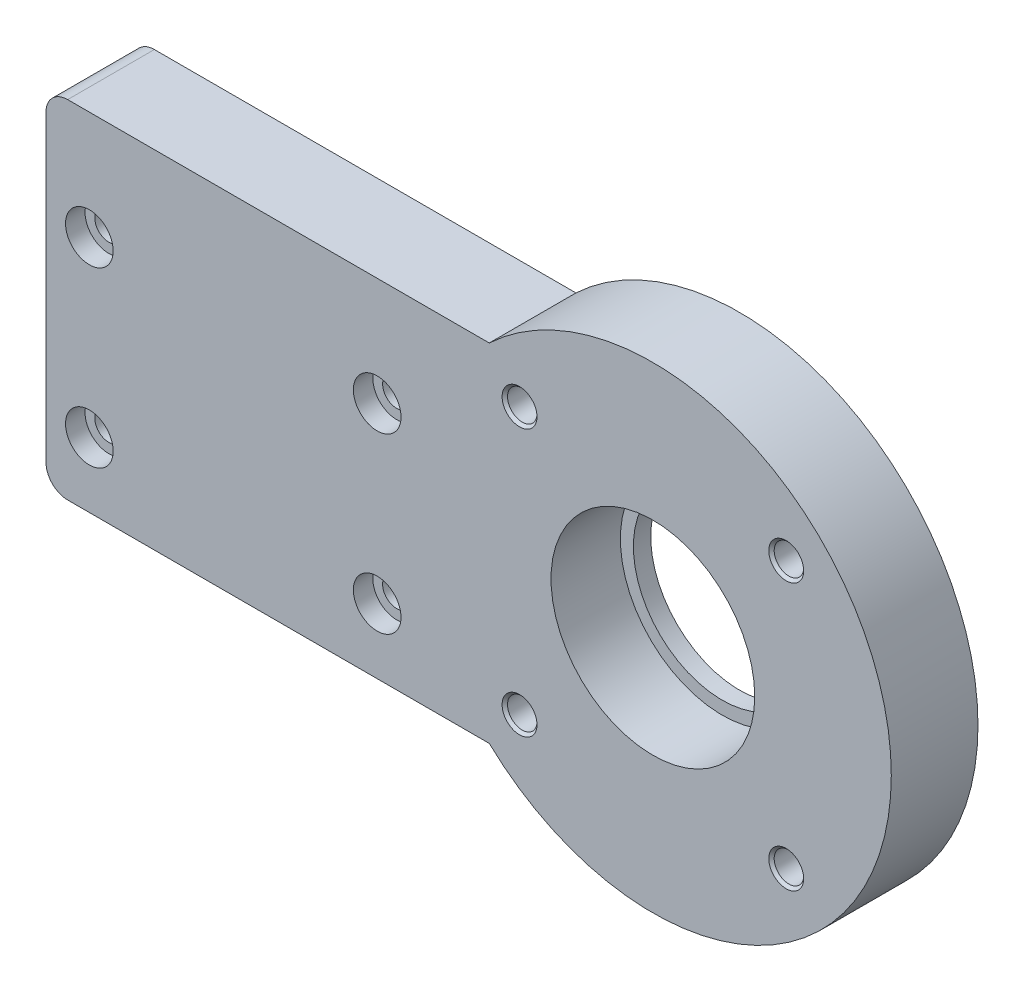
from build123d import *

# Parameters (mm, degrees)
SKETCH1_R                   = 20.5
BOSS_EXTRUDE1_DEPTH         = 20
BOSS_EXTRUDE3_START         = -20
SKETCH6_R                   = 55
SKETCH6_R_2                 = 20.5
BOSS_EXTRUDE3_DEPTH         = 20
SKETCH2_R                   = 23.5
CUT_EXTRUDE1_DEPTH          = 16
SKETCH4_W                   = 85
SKETCH4_H                   = 8
BOSS_EXTRUDE2_DEPTH         = 3
SKETCH3_R                   = 3.25
CUT_EXTRUDE2_DEPTH          = 153.164384795
SKETCH5_R                   = 5.5
CUT_EXTRUDE3_DEPTH          = 4.5
FILLET1_R                   = 5
M8_TAPPED_HOLE1_D           = 6.8
M8_TAPPED_HOLE1_DEPTH       = 16
M8_TAPPED_HOLE1_CSINK_D     = 8.05
M8_TAPPED_HOLE1_CSINK_ANGLE = 90
M8_TAPPED_HOLE1_TIP         = 2.042926105


with BuildPart() as part:
    # Sketch1 → Boss-Extrude1 (new body)
    with BuildSketch(Plane.XY):
        with BuildLine():
            Line((0, 40), (-140, 40))
            Line((-140, 40), (-140, -40))
            Line((-140, -40), (0, -40))
            ThreePointArc((0, -40), (40, 0), (0, 40))
        make_face()
        Circle(SKETCH1_R, mode=Mode.SUBTRACT)
    extrude(amount=BOSS_EXTRUDE1_DEPTH)

    # Sketch6 → Boss-Extrude3 (add)
    with BuildSketch(Plane.XY.offset(20).offset(BOSS_EXTRUDE3_START)):
        Circle(SKETCH6_R)
        Circle(SKETCH6_R_2, mode=Mode.SUBTRACT)
    extrude(amount=BOSS_EXTRUDE3_DEPTH)

    # Sketch2 → Cut-Extrude1 (cut)
    with BuildSketch(Plane.XY.offset(20)):
        Circle(SKETCH2_R)
    extrude(amount=-CUT_EXTRUDE1_DEPTH, mode=Mode.SUBTRACT)

    # Sketch4 → Boss-Extrude2 (add)
    with BuildSketch(Plane(origin=(0, 0, 0), x_dir=(-1, 0, 0), z_dir=(0, 0, -1))):
        with Locations((97.5, -25)):
            Rectangle(SKETCH4_W, SKETCH4_H)
        with Locations((97.5, 15)):
            Rectangle(SKETCH4_W, SKETCH4_H)
    extrude(amount=BOSS_EXTRUDE2_DEPTH)

    # Sketch3 → Cut-Extrude2 (cut, through all)
    with BuildSketch(Plane.XY.offset(20)):
        with Locations((-63.6, 15)):
            Circle(SKETCH3_R)
        with Locations((-130, 15)):
            Circle(SKETCH3_R)
        with Locations((-130, -25)):
            Circle(SKETCH3_R)
        with Locations((-63.6, -25)):
            Circle(SKETCH3_R)
    extrude(amount=-CUT_EXTRUDE2_DEPTH, mode=Mode.SUBTRACT)

    # Sketch5 → Cut-Extrude3 (cut)
    with BuildSketch(Plane.XY.offset(20)):
        with Locations((-130, 15)):
            Circle(SKETCH5_R)
        with Locations((-63.6, 15)):
            Circle(SKETCH5_R)
        with Locations((-63.6, -25)):
            Circle(SKETCH5_R)
        with Locations((-130, -25)):
            Circle(SKETCH5_R)
    extrude(amount=-CUT_EXTRUDE3_DEPTH, mode=Mode.SUBTRACT)

    # Fillet1
    fillet1_edges = [part.edges().sort_by_distance(p)[0] for p in [
        (-140, -40, 10),
        (-140, 40, 10),
    ]]
    fillet(fillet1_edges, radius=FILLET1_R)

    # M8 Tapped Hole1
    with Locations(Plane.XY.offset(20)):
        with Locations((30.759144982, 30.759144982), (-30.759144982, 30.759144982), (-30.759144982, -30.759144982), (30.759144982, -30.759144982)):
            CounterSinkHole(M8_TAPPED_HOLE1_D / 2, M8_TAPPED_HOLE1_CSINK_D / 2, depth=M8_TAPPED_HOLE1_DEPTH, counter_sink_angle=M8_TAPPED_HOLE1_CSINK_ANGLE)
            with Locations((0, 0, -(M8_TAPPED_HOLE1_DEPTH + M8_TAPPED_HOLE1_TIP / 2))):  # 118° drill point
                Cone(0, M8_TAPPED_HOLE1_D / 2, M8_TAPPED_HOLE1_TIP, mode=Mode.SUBTRACT)


solid = part.part
